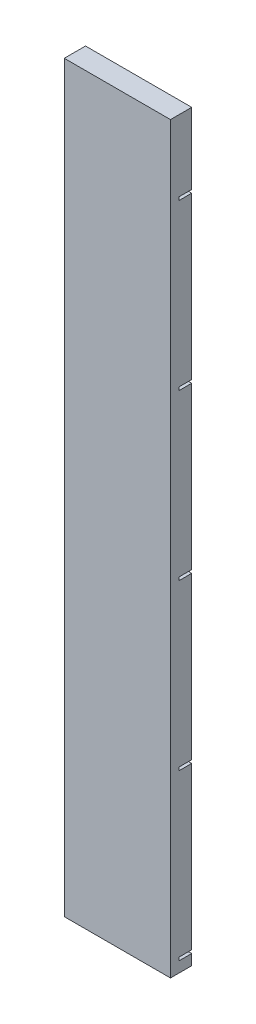
from build123d import *

# Parameters (mm, degrees)
BOSS_EXTRUDE1_DEPTH = 50


with BuildPart() as part:
    # Sketch1 → Boss-Extrude1 (new body)
    with BuildSketch(Plane(origin=(0, 0, 0), x_dir=(0, 0, -1), z_dir=(1, 0, 0))):
        Polygon((10, 6.5), (10, 82.5), (4, 82.5), (4, 84), (10, 84), (10, 160), (4, 160), (4, 161.5), (10, 161.5), (10, 237.5), (4, 237.5), (4, 239), (10, 239), (10, 315), (4, 315), (4, 316.5), (10, 316.5), (10, 350), (0, 350), (0, 0), (10, 0), (10, 5), (4, 5), (4, 6.5), align=None)
    extrude(amount=BOSS_EXTRUDE1_DEPTH)


solid = part.part
